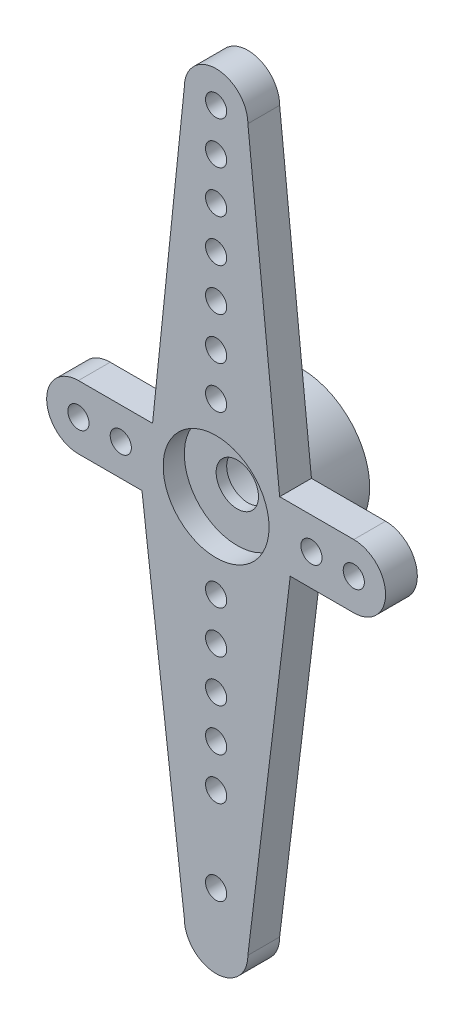
from build123d import *

# Parameters (mm, degrees)
SKETCH_1_R          = 0.5
SKETCH_1_R_2        = 1
EXTRUDE_1_DEPTH     = 1.5
SKETCH_2_R          = 3.25
SKETCH_2_R_2        = 2
EXTRUDE_2_DEPTH     = 2.5
SKETCH_3_R          = 2.5
CUT_EXTRUDE_1_DEPTH = 1


with BuildPart() as part:
    # 草图1 → 凸台-拉伸1 (new body)
    with BuildSketch(Plane.XY):
        with BuildLine():
            Line((1.5, 16), (3, 1.5))
            Line((3, 1.5), (6.5, 1.5))
            ThreePointArc((6.5, 1.5), (8, 0), (6.5, -1.5))
            Line((6.5, -1.5), (3.5, -1.5))
            Line((3.5, -1.5), (1.5, -18))
            ThreePointArc((1.5, -18), (0, -19.5), (-1.5, -18))
            Line((-1.5, -18), (-3.5, -1.5))
            Line((-3.5, -1.5), (-6.5, -1.5))
            ThreePointArc((-6.5, -1.5), (-8, 0), (-6.5, 1.5))
            Line((-6.5, 1.5), (-3, 1.5))
            Line((-3, 1.5), (-1.5, 16))
            ThreePointArc((-1.5, 16), (0, 17.5), (1.5, 16))
        make_face()
        with Locations((-6.5, 0)):
            Circle(SKETCH_1_R, mode=Mode.SUBTRACT)
        Circle(SKETCH_1_R_2, mode=Mode.SUBTRACT)
        with Locations((-4.5, 0)):
            Circle(SKETCH_1_R, mode=Mode.SUBTRACT)
        with Locations(Location((4.5, 0, 0), (0, 0, 180))):
            Circle(SKETCH_1_R, mode=Mode.SUBTRACT)
        with Locations(Location((6.5, 0, 0), (0, 0, 180))):
            Circle(SKETCH_1_R, mode=Mode.SUBTRACT)
        with Locations((0, 16)):
            Circle(SKETCH_1_R, mode=Mode.SUBTRACT)
        with Locations((0, 14)):
            Circle(SKETCH_1_R, mode=Mode.SUBTRACT)
        with Locations((0, 12)):
            Circle(SKETCH_1_R, mode=Mode.SUBTRACT)
        with Locations((0, 10)):
            Circle(SKETCH_1_R, mode=Mode.SUBTRACT)
        with Locations((0, 8)):
            Circle(SKETCH_1_R, mode=Mode.SUBTRACT)
        with Locations((0, 6)):
            Circle(SKETCH_1_R, mode=Mode.SUBTRACT)
        with Locations((0, 4)):
            Circle(SKETCH_1_R, mode=Mode.SUBTRACT)
        with Locations(Location((0, -16, 0), (0, 0, 180))):
            Circle(SKETCH_1_R, mode=Mode.SUBTRACT)
        with Locations(Location((0, -4, 0), (0, 0, 180))):
            Circle(SKETCH_1_R, mode=Mode.SUBTRACT)
        with Locations(Location((0, -6, 0), (0, 0, 180))):
            Circle(SKETCH_1_R, mode=Mode.SUBTRACT)
        with Locations(Location((0, -8, 0), (0, 0, 180))):
            Circle(SKETCH_1_R, mode=Mode.SUBTRACT)
        with Locations(Location((0, -10, 0), (0, 0, 180))):
            Circle(SKETCH_1_R, mode=Mode.SUBTRACT)
        with Locations(Location((0, -12, 0), (0, 0, 180))):
            Circle(SKETCH_1_R, mode=Mode.SUBTRACT)
    extrude(amount=EXTRUDE_1_DEPTH)

    # 草图2 → 凸台-拉伸2 (add)
    with BuildSketch(Plane(origin=(0, 0, 0), x_dir=(-1, 0, 0), z_dir=(0, 0, -1))):
        with Locations(Location((0, 0, 0), (0, 0, 180))):
            Circle(SKETCH_2_R)
        Circle(SKETCH_2_R_2, mode=Mode.SUBTRACT)
    extrude(amount=EXTRUDE_2_DEPTH)

    # 草图3 → 切除-拉伸1 (cut)
    with BuildSketch(Plane.XY.offset(1.5)):
        Circle(SKETCH_3_R)
    extrude(amount=-CUT_EXTRUDE_1_DEPTH, mode=Mode.SUBTRACT)


solid = part.part
